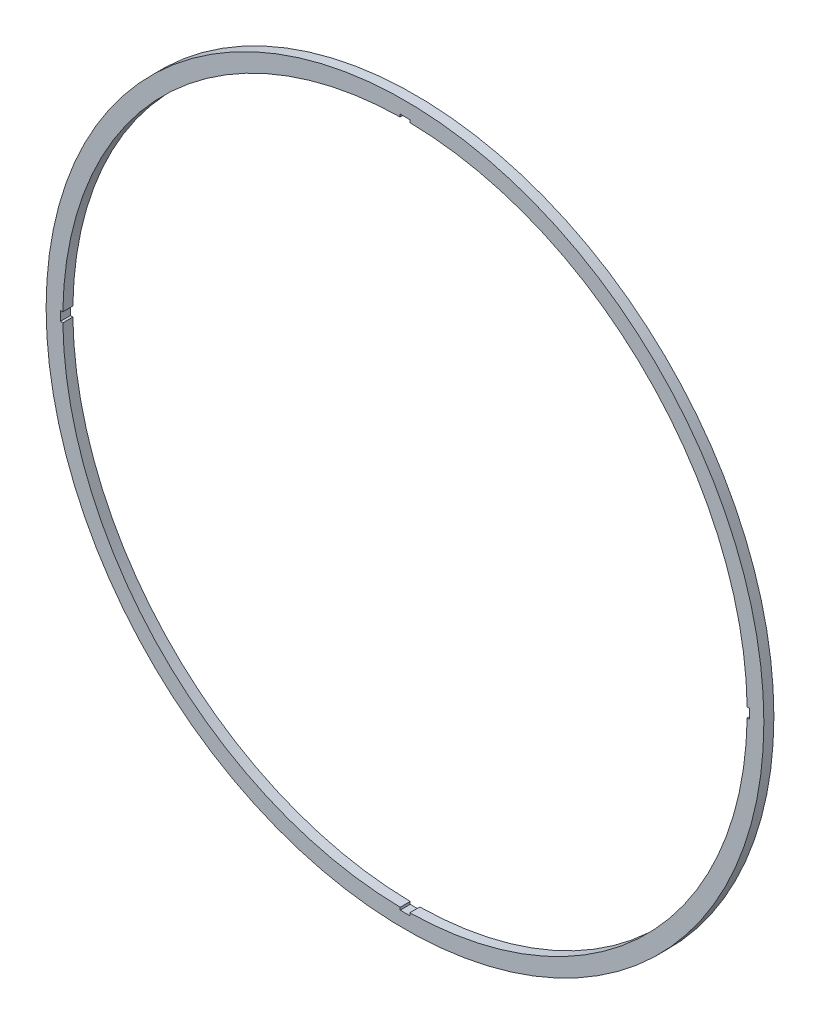
from build123d import *

# Parameters (mm, degrees)
SKETCH1_R           = 430
BOSS_EXTRUDE1_DEPTH = 12


with BuildPart() as part:
    # Sketch1 → Boss-Extrude1 (new body)
    with BuildSketch(Plane.XY):
        Circle(SKETCH1_R)
        with BuildLine():
            Line((413.001947093, 5.720930233), (409.96008459, 5.720930233))
            ThreePointArc((409.96008459, 5.720930233), (289.913780286, 289.913780286), (5.720930233, 409.96008459))
            Line((5.720930233, 409.96008459), (5.720930233, 413.001947093))
            Line((5.720930233, 413.001947093), (-5.720930233, 413.001947093))
            Line((-5.720930233, 413.001947093), (-5.720930233, 409.96008459))
            ThreePointArc((-5.720930233, 409.96008459), (-289.913780286, 289.913780286), (-409.96008459, 5.720930233))
            Line((-409.96008459, 5.720930233), (-413.001947093, 5.720930233))
            Line((-413.001947093, 5.720930233), (-413.001947093, -5.720930233))
            Line((-413.001947093, -5.720930233), (-409.96008459, -5.720930233))
            ThreePointArc((-409.96008459, -5.720930233), (-289.913780286, -289.913780286), (-5.720930233, -409.96008459))
            Line((-5.720930233, -409.96008459), (-5.720930233, -413.001947093))
            Line((-5.720930233, -413.001947093), (5.720930233, -413.001947093))
            Line((5.720930233, -413.001947093), (5.720930233, -409.96008459))
            ThreePointArc((5.720930233, -409.96008459), (289.913780286, -289.913780286), (409.96008459, -5.720930233))
            Line((409.96008459, -5.720930233), (413.001947093, -5.720930233))
            Line((413.001947093, -5.720930233), (413.001947093, 5.720930233))
        make_face(mode=Mode.SUBTRACT)
    extrude(amount=BOSS_EXTRUDE1_DEPTH)


solid = part.part
